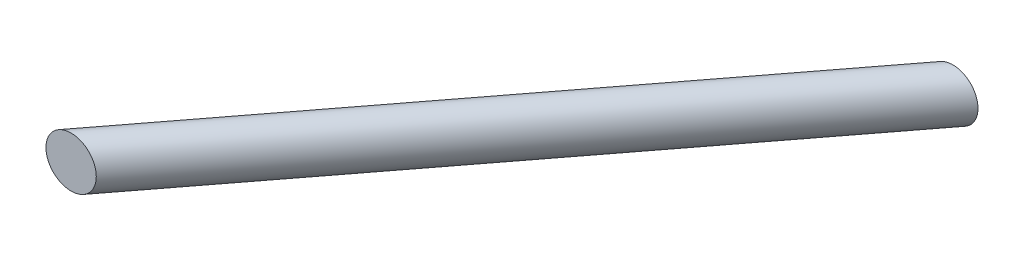
from build123d import *

# Parameters (mm, degrees)
SKETCH5_R           = 2
BOSS_EXTRUDE1_DEPTH = 50


with BuildPart() as part:
    # Sketch5 → Boss-Extrude1 (new, along a direction that is not the sketch's normal)
    with BuildSketch(Plane.XY):
        Circle(SKETCH5_R)
    extrude(amount=BOSS_EXTRUDE1_DEPTH, dir=(-0.6069598019618953, 0, 0.7947325328702588))


solid = part.part
